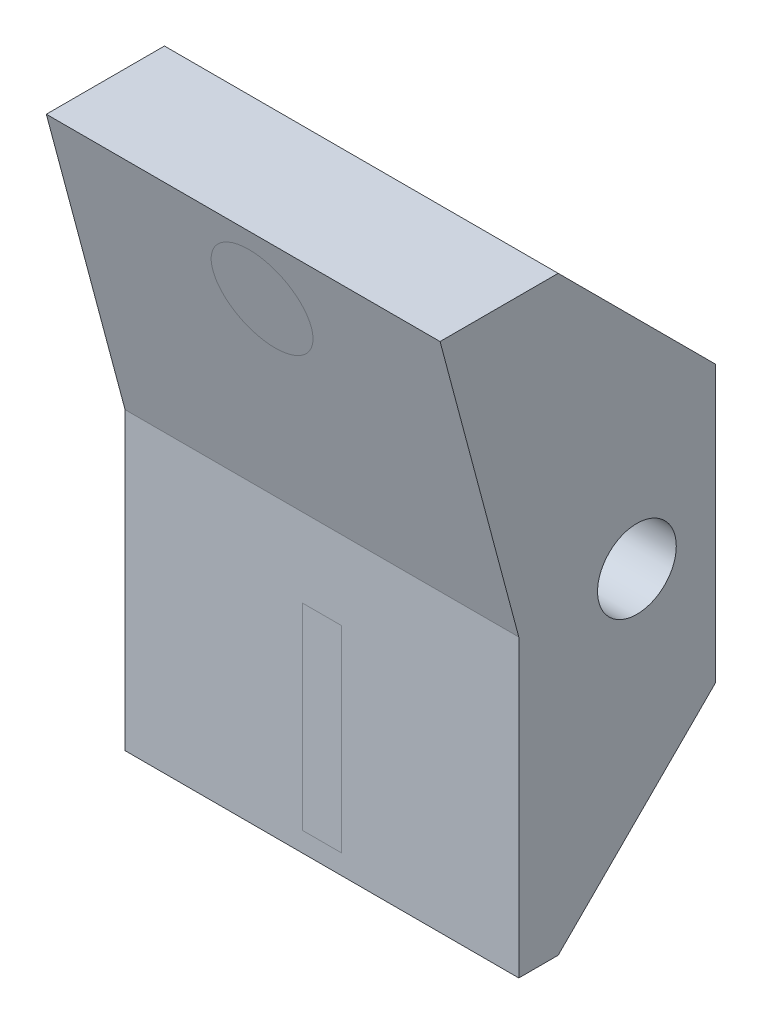
from build123d import *

# Parameters (mm, degrees)
SKETCH1_W           = 127
SKETCH1_H           = 190.5
BOSS_EXTRUDE1_DEPTH = 63.5
SKETCH4_W           = 127
SKETCH4_H           = 71.842048968
CUT_EXTRUDE1_DEPTH  = 63.5
SKETCH5_R           = 12.7
CUT_EXTRUDE2_DEPTH  = 137.16
BOSS_EXTRUDE2_DEPTH = 127


with BuildPart() as part:
    # Sketch1 → Boss-Extrude1 (new body)
    with BuildSketch(Plane.XY):
        Rectangle(SKETCH1_W, SKETCH1_H)
    extrude(amount=BOSS_EXTRUDE1_DEPTH)

    # Sketch4 → Cut-Extrude1 (cut)
    with BuildSketch(Plane(origin=(0, -22.225, -22.225), x_dir=(1, 0, 0), z_dir=(0, 0.7071067811865477, 0.7071067811865475))):
        with Locations((0, -67.351920908)):
            Rectangle(SKETCH4_W, SKETCH4_H)
    cut_extrude1 = extrude(amount=-CUT_EXTRUDE1_DEPTH, mode=Mode.SUBTRACT)

    # Sketch5 → Cut-Extrude2 (cut)
    with BuildSketch(Plane(origin=(63.5, 0, 0), x_dir=(0, 0, -1), z_dir=(1, 0, 0))):
        with Locations((-25.4, 0)):
            Circle(SKETCH5_R)
    extrude(amount=-CUT_EXTRUDE2_DEPTH, mode=Mode.SUBTRACT)

    # Mirror1: Cut-Extrude1 across plane
    add(cut_extrude1.mirror(Plane.ZX), mode=Mode.SUBTRACT)

    # Sketch7 → Boss-Extrude2 (add)
    with BuildSketch(Plane(origin=(63.5, 0, 0), x_dir=(0, 0, -1), z_dir=(1, 0, 0))):
        Polygon((-63.5, 95.25), (-88.9, 95.25), (-63.5, 0), align=None)
    extrude(amount=-BOSS_EXTRUDE2_DEPTH)


solid = part.part
